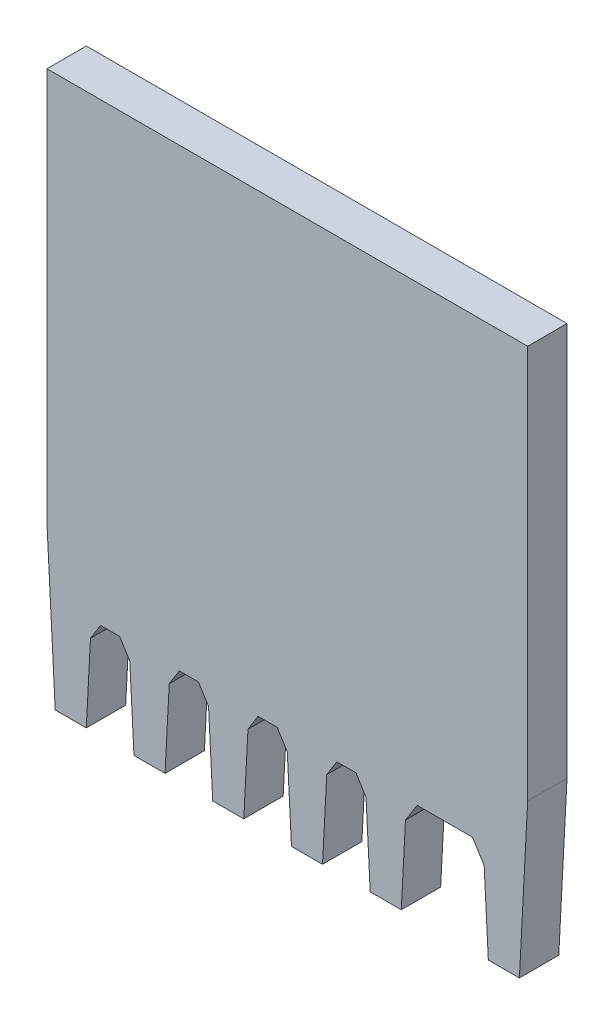
from build123d import *

# Parameters (mm, degrees)
BOSS_EXTRUDE1_DEPTH = 1.5


with BuildPart() as part:
    # Sketch1 → Boss-Extrude1 (new body)
    with BuildSketch(Plane.XY):
        Polygon((0, 6), (0.314446676, 0), (1.497941481, 0), (1.657221927, 3.039251967), (2.042586863, 3.65596478), (2.769801294, 3.65596478), (3.155166229, 3.039251967), (3.314446676, 0), (4.497941481, 0), (4.657221927, 3.039251967), (5.042586863, 3.65596478), (5.769801294, 3.65596478), (6.155166229, 3.039251967), (6.314446676, 0), (7.497941481, 0), (7.657221927, 3.039251967), (8.042586863, 3.65596478), (8.769801294, 3.65596478), (9.155166229, 3.039251967), (9.314446676, 0), (10.497941481, 0), (10.657221927, 3.039251967), (11.042586863, 3.65596478), (11.769801294, 3.65596478), (12.155166229, 3.039251967), (12.314446676, 0), (13.497941481, 0), (13.657221927, 3.039251967), (14.10134659, 3.75), (16.211041567, 3.75), (16.655166229, 3.039251967), (16.814446676, 0), (17.997941481, 0), (18.312388157, 6), (18.312388157, 21), (0, 21), align=None)
    extrude(amount=BOSS_EXTRUDE1_DEPTH)


solid = part.part
